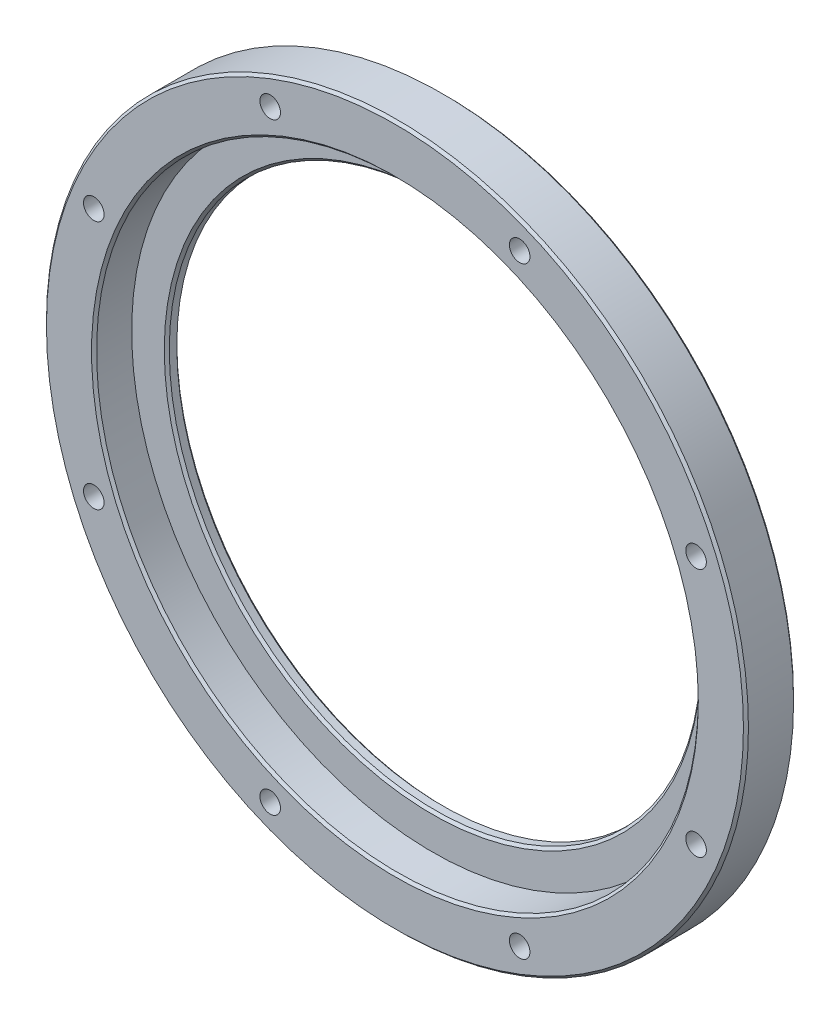
from build123d import *

# Parameters (mm, degrees)
SKETCH1_W                  = 140
SKETCH1_H                  = 20
F_8_2_8_2_DIAMETER_HOLE1_D = 8.2
HOLE1_D                    = 212
HOLE1_CBORE_D              = 240
HOLE1_CBORE_DEPTH          = 15
CHAMFER1_SIZE              = 1


with BuildPart() as part:
    # Sketch1 → Revolve1 (revolve)
    with BuildSketch(Plane.XZ, mode=Mode.PRIVATE) as revolve1_sk:
        with Locations((70, 10)):
            Rectangle(SKETCH1_W, SKETCH1_H)
    revolve(revolve1_sk.sketch.rotate(Axis((0, 0, 20), (0, 0, -1)), 180), axis=Axis((0, 0, 20), (0, 0, -1)))

    # Ø8.2 (8.2) Diameter Hole1 (through all)
    with Locations(Plane.XY.offset(20)):
        with Locations((49.748846207, 120.104339226), (120.104339226, 49.748846207), (120.104339226, -49.748846207), (49.748846207, -120.104339226), (-49.748846207, -120.104339226), (-120.104339226, -49.748846207), (-120.104339226, 49.748846207), (-49.748846207, 120.104339226)):
            Hole(F_8_2_8_2_DIAMETER_HOLE1_D / 2)

    # Hole1 (through all)
    with Locations(Plane.XY.offset(20)):
        with Locations((0, 0)):
            CounterBoreHole(HOLE1_D / 2, HOLE1_CBORE_D / 2, HOLE1_CBORE_DEPTH)

    # Chamfer1
    chamfer1_edges = [part.edges().sort_by_distance(p)[0] for p in [
        (140, 0, 0),
        (140, 0, 20),
        (-120, 0, 20),
        (106, 0, 0),
        (106, 0, 5),
    ]]
    chamfer(chamfer1_edges, length=CHAMFER1_SIZE)


solid = part.part
